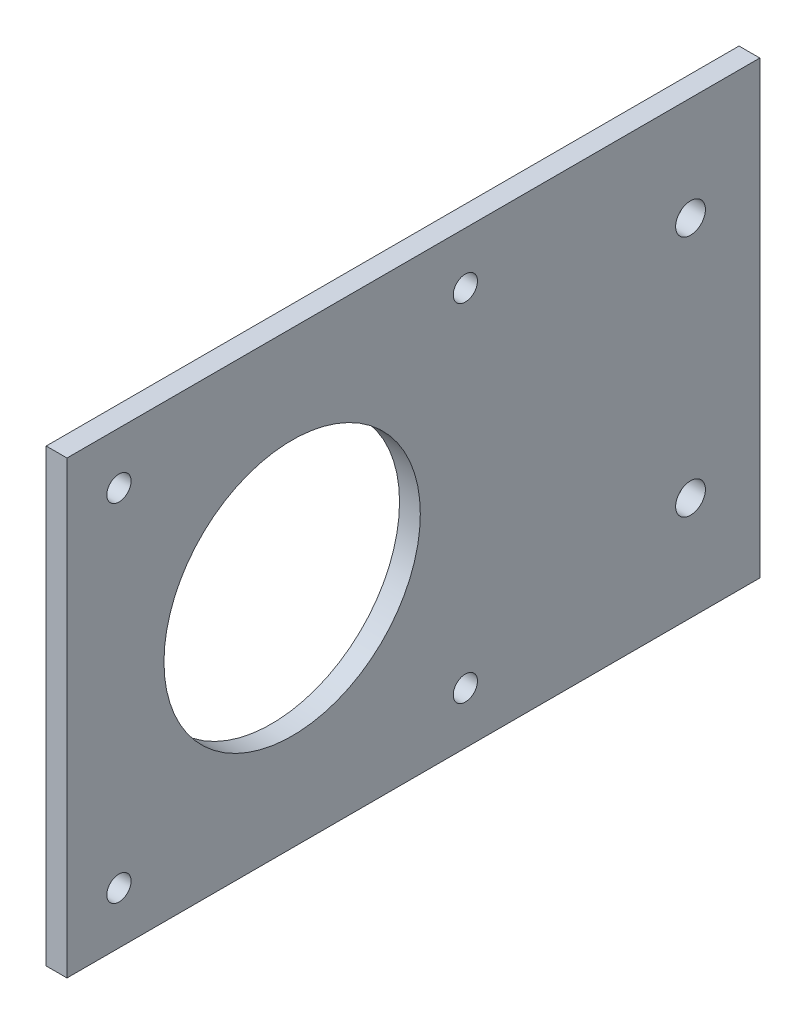
from build123d import *

# Parameters (mm, degrees)
SKETCH1_W           = 100
SKETCH1_H           = 65
SKETCH1_R           = 18.5
SKETCH1_R_2         = 2.15
SKETCH1_R_3         = 1.75
BOSS_EXTRUDE1_DEPTH = 3


with BuildPart() as part:
    # Sketch1 → Boss-Extrude1 (new body)
    with BuildSketch(Plane(origin=(0, 0, 0), x_dir=(0, 0, -1), z_dir=(1, 0, 0))):
        with Locations((50, 32.5)):
            Rectangle(SKETCH1_W, SKETCH1_H)
        with Locations((32.5, 32.5)):
            Circle(SKETCH1_R, mode=Mode.SUBTRACT)
        with Locations((90, 50)):
            Circle(SKETCH1_R_2, mode=Mode.SUBTRACT)
        with Locations((90, 15)):
            Circle(SKETCH1_R_2, mode=Mode.SUBTRACT)
        with Locations((7.5, 57.5)):
            Circle(SKETCH1_R_3, mode=Mode.SUBTRACT)
        with Locations((57.5, 57.5)):
            Circle(SKETCH1_R_3, mode=Mode.SUBTRACT)
        with Locations((7.5, 7.5)):
            Circle(SKETCH1_R_3, mode=Mode.SUBTRACT)
        with Locations((57.5, 7.5)):
            Circle(SKETCH1_R_3, mode=Mode.SUBTRACT)
    extrude(amount=BOSS_EXTRUDE1_DEPTH)


solid = part.part
